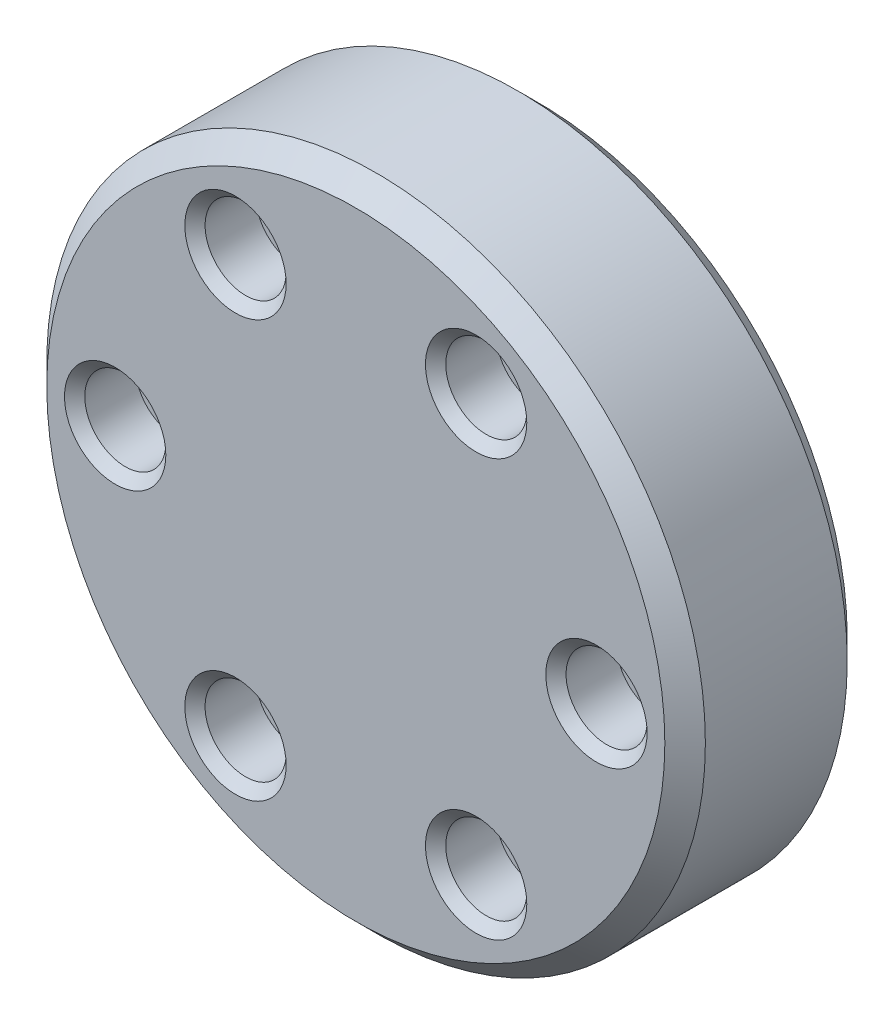
from build123d import *

# Parameters (mm, degrees)
SKETCH_1_R                           = 32.5
EXTRUDE_1_DEPTH                      = 9
CHAMFER_1_SIZE                       = 2
SKETCH_3_R                           = 2.6
CUT_EXTRUDE_1_DEPTH                  = 47.834816109
CUT_EXTRUDE_START                    = 9
SKETCH_4_R                           = 4
CUT_EXTRUDE_2_DEPTH                  = 6
CHAMFER_2_SIZE                       = 1
PATTERN_CIRCULAR_1_COUNT             = 6
CHAMFER_2_OF_PATTERN_CIRCULAR_1_SIZE = 1
SKETCH_5_R                           = 28.4
CUT_EXTRUDE_3_DEPTH                  = 10


with BuildPart() as part:
    # ｽｹｯﾁ1 → ﾎﾞｽ - 押し出し1 (new, symmetric)
    with BuildSketch(Plane.XY):
        Circle(SKETCH_1_R)
    extrude(amount=EXTRUDE_1_DEPTH, both=True)

    # 面取り1
    chamfer_1_edges = [part.edges().sort_by_distance(p)[0] for p in [
        (-32.5, 0, -9),
        (-32.5, 0, 9),
    ]]
    chamfer(chamfer_1_edges, length=CHAMFER_1_SIZE)

    # ｽｹｯﾁ3 → ｶｯﾄ - 押し出し1 (cut, symmetric)
    with BuildSketch(Plane.XY):
        with Locations((11.875, 20.56810334)):
            Circle(SKETCH_3_R)
    cut_extrude_1 = extrude(amount=CUT_EXTRUDE_1_DEPTH, both=True, mode=Mode.SUBTRACT)

    # ｽｹｯﾁ4 → ｶｯﾄ - 押し出し2 (cut)
    with BuildSketch(Plane.XY.offset(CUT_EXTRUDE_START)):
        with Locations((11.875, 20.56810334)):
            Circle(SKETCH_4_R)
    cut_extrude_2 = extrude(amount=-CUT_EXTRUDE_2_DEPTH, mode=Mode.SUBTRACT)

    # 面取り2
    chamfer_2_edges = [part.edges().sort_by_distance(p)[0] for p in [
        (7.875, 20.56810334, 9),
    ]]
    chamfer(chamfer_2_edges, length=CHAMFER_2_SIZE)

    # 円形ﾊﾟﾀｰﾝ1: ｶｯﾄ - 押し出し1, ｶｯﾄ - 押し出し2 ×6 about axis
    pattern_circular_1_axis = Axis((0, 0, 0), (0, 0, 1))
    add([cut_extrude_1.rotate(pattern_circular_1_axis, i * 360 / PATTERN_CIRCULAR_1_COUNT) for i in range(1, PATTERN_CIRCULAR_1_COUNT)], mode=Mode.SUBTRACT)
    add([cut_extrude_2.rotate(pattern_circular_1_axis, i * 360 / PATTERN_CIRCULAR_1_COUNT) for i in range(1, PATTERN_CIRCULAR_1_COUNT)], mode=Mode.SUBTRACT)

    # 面取り2 of 円形ﾊﾟﾀｰﾝ1
    chamfer_2_of_pattern_circular_1_edges = [part.edges().sort_by_distance(p)[0] for p in [
        (-13.875, 17.104001725, 9),
        (-21.75, -3.464101615, 9),
        (-7.875, -20.56810334, 9),
        (13.875, -17.104001725, 9),
        (21.75, 3.464101615, 9),
    ]]
    chamfer(chamfer_2_of_pattern_circular_1_edges, length=CHAMFER_2_OF_PATTERN_CIRCULAR_1_SIZE)

    # ｽｹｯﾁ5 → ｶｯﾄ - 押し出し3 (cut)
    with BuildSketch(Plane(origin=(0, 0, -9), x_dir=(-1, 0, 0), z_dir=(0, 0, -1))):
        Circle(SKETCH_5_R)
    extrude(amount=-CUT_EXTRUDE_3_DEPTH, mode=Mode.SUBTRACT)


solid = part.part
